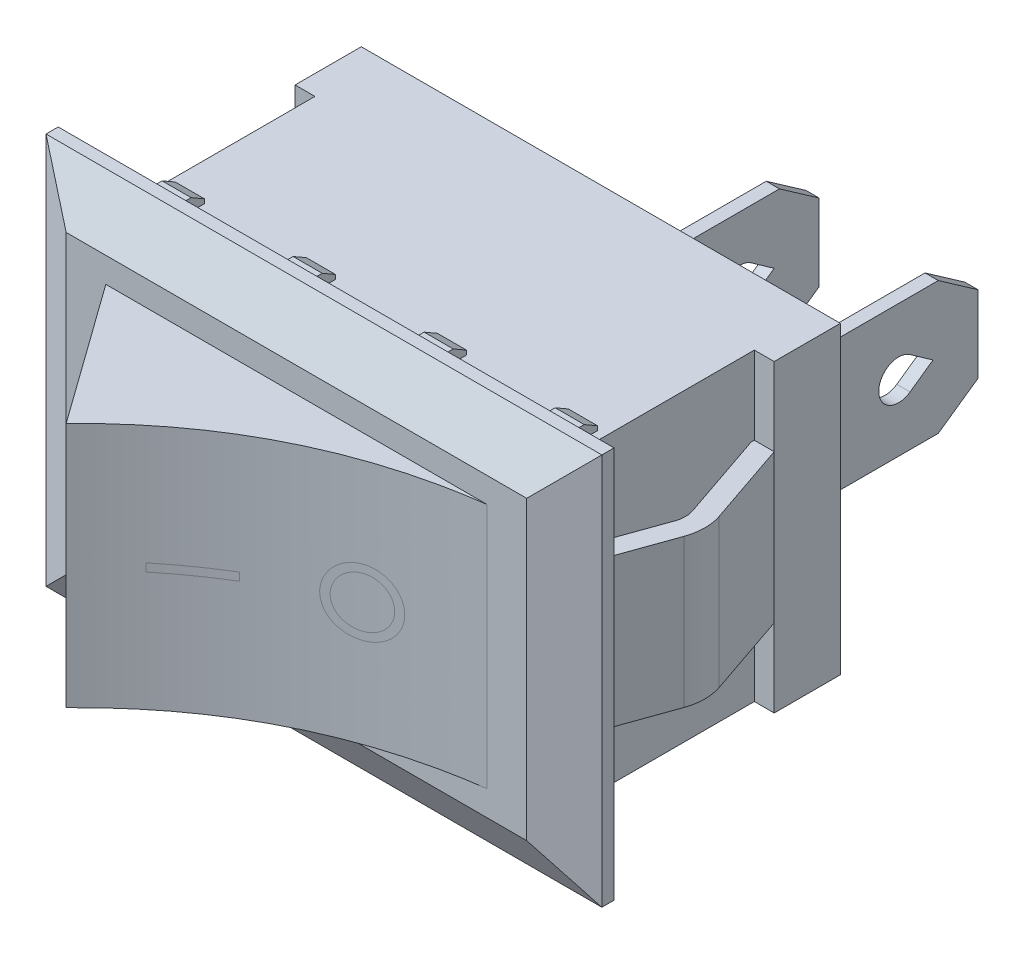
from build123d import *
from OCP.BRepFilletAPI import BRepFilletAPI_MakeChamfer

# Parameters (mm, degrees)
SKETCH1_W                       = 16.6
SKETCH1_H                       = 11.5
BOSS_EXTRUDE1_DEPTH             = 10
SKETCH2_W                       = 21
SKETCH2_H                       = 14.8
BOSS_EXTRUDE2_DEPTH             = 1.5
SKETCH3_W                       = 0.5
SKETCH3_H                       = 5
BOSS_EXTRUDE3_DEPTH             = 8
SKETCH4_W                       = 0.5
SKETCH4_H                       = 0.4
CUT_EXTRUDE1_DEPTH              = 22.623424798
BOSS_EXTRUDE4_REACH             = 19.241
SKETCH5_W                       = 0.75
SKETCH5_H                       = 2.5
BOSS_EXTRUDE4_DIRECTION_2_REACH = 19.241
BOSS_EXTRUDE5_DEPTH             = 2.8
BOSS_EXTRUDE5_DEPTH_BACK        = 2.8
CHAMFER1_SIZE                   = 1.8
CHAMFER1_SIZE2                  = 1.039230485
BOSS_EXTRUDE6_DEPTH             = 4.65
SKETCH9_W                       = 1.1
SKETCH9_H                       = 0.45
BOSS_EXTRUDE7_DEPTH             = 1.9
CHAMFER2_SIZE                   = 0.5
CHAMFER2_SIZE2                  = 0.288675135


with BuildPart() as part:
    # Sketch1 → Boss-Extrude1 (new body)
    with BuildSketch(Plane.XY):
        Rectangle(SKETCH1_W, SKETCH1_H)
    extrude(amount=BOSS_EXTRUDE1_DEPTH)

    # Sketch2 → Boss-Extrude2 (add)
    with BuildSketch(Plane.XY.offset(10)):
        Rectangle(SKETCH2_W, SKETCH2_H)
    extrude(amount=BOSS_EXTRUDE2_DEPTH)

    # Sketch3 → Boss-Extrude3 (add)
    with BuildSketch(Plane(origin=(0, 0, 0), x_dir=(-1, 0, 0), z_dir=(0, 0, -1))):
        with Locations((-6, 0)):
            Rectangle(SKETCH3_W, SKETCH3_H)
        Rectangle(SKETCH3_W, SKETCH3_H)
    extrude(amount=BOSS_EXTRUDE3_DEPTH)

    # Sketch4 → Cut-Extrude1 (cut, through all)
    with BuildSketch(Plane(origin=(6.25, 0, 0), x_dir=(0, 0, -1), z_dir=(1, 0, 0))):
        with Locations((2.25, 2.3)):
            Rectangle(SKETCH4_W, SKETCH4_H)
        with BuildLine():
            Line((0, 0.75), (0, -0.75))
            ThreePointArc((0, -0.75), (0.75, 0), (0, 0.75))
        make_face()
        Polygon((6.5, 2.5), (8, 1.449688693), (8, 2.5), align=None)
        with BuildLine():
            Line((5.432692308, 0.612598863), (6.3, 0))
            Line((6.3, 0), (5.432692308, -0.612598863))
            ThreePointArc((5.432692308, -0.612598863), (4.25, 0), (5.432692308, 0.612598863))
        make_face()
        Polygon((8, -2.5), (8, -1.449688693), (6.5, -2.5), align=None)
        with Locations((2.25, -2.3)):
            Rectangle(SKETCH4_W, SKETCH4_H)
    extrude(amount=-CUT_EXTRUDE1_DEPTH, mode=Mode.SUBTRACT)

    # Boss-Extrude4: up to this face of the body (flat: up to its plane)
    boss_extrude4_end = Plane(part.part.faces().sort_by_distance((0, 5.75, 5))[0])
    # Sketch5 → Boss-Extrude4 (add, up to the picked face)
    with BuildSketch(Plane(origin=(0, 0, 0), x_dir=(1, 0, 0), z_dir=(0, 1, 0)), mode=Mode.PRIVATE) as boss_extrude4_sk1:
        with Locations((-8.675, -1.25)):
            Rectangle(SKETCH5_W, SKETCH5_H)
    boss_extrude4_tool1 = split(extrude(boss_extrude4_sk1.sketch, amount=BOSS_EXTRUDE4_REACH, mode=Mode.PRIVATE), bisect_by=boss_extrude4_end, keep=Keep.BOTH, mode=Mode.PRIVATE)
    boss_extrude4 = boss_extrude4_tool1.solids().sort_by(Axis((-8.675, 0, 1.25), (0, 1, 0)))[0]
    add(boss_extrude4)

    # Boss-Extrude4 direction 2: up to this face of the body (flat: up to its plane)
    boss_extrude4_direction_2_end = Plane(part.part.faces().sort_by_distance((0, -5.75, 5))[0])
    # Sketch5 → Boss-Extrude4 direction 2 (add, up to the picked face)
    with BuildSketch(Plane(origin=(0, 0, 0), x_dir=(1, 0, 0), z_dir=(0, 1, 0)), mode=Mode.PRIVATE) as boss_extrude4_direction_2_sk1:
        with Locations((-8.675, -1.25)):
            Rectangle(SKETCH5_W, SKETCH5_H)
    boss_extrude4_direction_2_tool1 = split(extrude(boss_extrude4_direction_2_sk1.sketch, amount=-BOSS_EXTRUDE4_DIRECTION_2_REACH, mode=Mode.PRIVATE), bisect_by=boss_extrude4_direction_2_end, keep=Keep.BOTH, mode=Mode.PRIVATE)
    boss_extrude4_direction_2 = boss_extrude4_direction_2_tool1.solids().sort_by(Axis((-8.675, 0, 1.25), (0, -1, 0)))[0]
    add(boss_extrude4_direction_2)

    # Mirror1: Boss-Extrude4, Boss-Extrude4 direction 2 across plane
    add(boss_extrude4.mirror(Plane(origin=(0, 0, 0), x_dir=(0, 0, 1), z_dir=(1, 0, 0))))
    add(boss_extrude4_direction_2.mirror(Plane(origin=(0, 0, 0), x_dir=(0, 0, 1), z_dir=(1, 0, 0))))

    # Sketch6 → Boss-Extrude5 (add, two sides: drawn at the far end of the back side and taken through both)
    with BuildSketch(Plane(origin=(0, 0, 0), x_dir=(1, 0, 0), z_dir=(0, 1, 0)).offset(-BOSS_EXTRUDE5_DEPTH_BACK)):
        with BuildLine():
            Line((-9.05, -2.5), (-10.124907983, -5.653347952))
            ThreePointArc((-10.124907983, -5.653347952), (-10.231819447, -6.312838644), (-10.115557515, -6.970745323))
            Line((-10.115557515, -6.970745323), (-9.056614332, -9.938626949))
            Line((-9.056614332, -9.938626949), (-9.034716365, -10))
            Line((-9.034716365, -10), (-8.3, -10))
            Line((-8.3, -10), (-8.3, -9.827371619))
            Line((-8.3, -9.827371619), (-8.350231447, -9.686588817))
            Line((-8.350231447, -9.686588817), (-9.438479941, -6.636573707))
            ThreePointArc((-9.438479941, -6.636573707), (-9.496610907, -6.307620368), (-9.443155175, -5.977875022))
            Line((-9.443155175, -5.977875022), (-8.34011069, -2.741985882))
            Line((-8.34011069, -2.741985882), (-8.3, -2.624317241))
            Line((-8.3, -2.624317241), (-8.3, -2.5))
            Line((-8.3, -2.5), (-9.05, -2.5))
        make_face()
        with BuildLine():
            Line((8.3, -9.827371619), (8.350231447, -9.686588817))
            Line((8.350231447, -9.686588817), (9.438479941, -6.636573707))
            ThreePointArc((9.438479941, -6.636573707), (9.496610907, -6.307620368), (9.443155175, -5.977875022))
            Line((9.443155175, -5.977875022), (8.34011069, -2.741985882))
            Line((8.34011069, -2.741985882), (8.3, -2.624317241))
            Line((8.3, -2.624317241), (8.3, -2.5))
            Line((8.3, -2.5), (9.05, -2.5))
            Line((9.05, -2.5), (10.124907983, -5.653347952))
            ThreePointArc((10.124907983, -5.653347952), (10.231819447, -6.312838644), (10.115557515, -6.970745323))
            Line((10.115557515, -6.970745323), (9.056614332, -9.938626949))
            Line((9.056614332, -9.938626949), (9.034716365, -10))
            Line((9.034716365, -10), (8.3, -10))
            Line((8.3, -10), (8.3, -9.827371619))
        make_face()
    extrude(amount=BOSS_EXTRUDE5_DEPTH + BOSS_EXTRUDE5_DEPTH_BACK)

    # Chamfer1
    chamfer1_edges = [part.edges().sort_by_distance(p)[0] for p in [
        (10.5, 0, 11.5),
        (0, 7.4, 11.5),
        (-10.5, 0, 11.5),
        (0, -7.4, 11.5),
    ]]
    chamfer1_side = [part.faces().sort_by_distance(p)[0] for p in [
        (0, 0, 11.5),
    ]]
    chamfer(chamfer1_edges, length=CHAMFER1_SIZE, length2=CHAMFER1_SIZE2, reference=chamfer1_side[0])

    # Sketch7 → Boss-Extrude6 (add, symmetric)
    with BuildSketch(Plane(origin=(0, 0, 0), x_dir=(1, 0, 0), z_dir=(0, 1, 0))):
        with BuildLine():
            Line((-7.2, -11.5), (-3.398718251, -16.8))
            add(Edge.make_bspline(
                [(-3.398718251, -16.8), (0.927387699, -12.334784825), (7.2, -11.5)],
                knots=[0, 0, 0, 1, 1, 1], degree=2))
            Line((7.2, -11.5), (-7.2, -11.5))
        make_face()
    extrude(amount=BOSS_EXTRUDE6_DEPTH, both=True)

    # Sketch9 → Boss-Extrude7 (add)
    with BuildSketch(Plane(origin=(0, 0, 10), x_dir=(-1, 0, 0), z_dir=(0, 0, -1))):
        with Locations((-7.425, 5.975)):
            Rectangle(SKETCH9_W, SKETCH9_H)
        with Locations((-2.475, 5.975)):
            Rectangle(SKETCH9_W, SKETCH9_H)
        with Locations((2.475, 5.975)):
            Rectangle(SKETCH9_W, SKETCH9_H)
        with Locations((7.425, 5.975)):
            Rectangle(SKETCH9_W, SKETCH9_H)
        with Locations((7.425, -5.975)):
            Rectangle(SKETCH9_W, SKETCH9_H)
        with Locations((2.475, -5.975)):
            Rectangle(SKETCH9_W, SKETCH9_H)
        with Locations((-2.475, -5.975)):
            Rectangle(SKETCH9_W, SKETCH9_H)
        with Locations((-7.425, -5.975)):
            Rectangle(SKETCH9_W, SKETCH9_H)
    extrude(amount=BOSS_EXTRUDE7_DEPTH)

    # Chamfer2: one chamfer whose edges measure the first distance from different faces: ONE call of the kernel's chamfer builder (chamfer() names one face for all edges)
    chamfer2_edges_1 = [part.edges().sort_by_distance(p)[0] for p in [
        (7.425, 6.2, 8.1),
    ]]
    chamfer2_side_1 = [part.faces().sort_by_distance(p)[0] for p in [
        (7.425, 6.2, 9.05),
    ]]
    chamfer2_edges_2 = [part.edges().sort_by_distance(p)[0] for p in [
        (2.475, 6.2, 8.1),
    ]]
    chamfer2_side_2 = [part.faces().sort_by_distance(p)[0] for p in [
        (2.475, 6.2, 9.05),
    ]]
    chamfer2_edges_3 = [part.edges().sort_by_distance(p)[0] for p in [
        (-2.475, 6.2, 8.1),
    ]]
    chamfer2_side_3 = [part.faces().sort_by_distance(p)[0] for p in [
        (-2.475, 6.2, 9.05),
    ]]
    chamfer2_edges_4 = [part.edges().sort_by_distance(p)[0] for p in [
        (-7.425, 6.2, 8.1),
    ]]
    chamfer2_side_4 = [part.faces().sort_by_distance(p)[0] for p in [
        (-7.425, 6.2, 9.05),
    ]]
    chamfer2_edges_5 = [part.edges().sort_by_distance(p)[0] for p in [
        (-7.425, -6.2, 8.1),
    ]]
    chamfer2_side_5 = [part.faces().sort_by_distance(p)[0] for p in [
        (-7.425, -6.2, 9.05),
    ]]
    chamfer2_edges_6 = [part.edges().sort_by_distance(p)[0] for p in [
        (-2.475, -6.2, 8.1),
    ]]
    chamfer2_side_6 = [part.faces().sort_by_distance(p)[0] for p in [
        (-2.475, -6.2, 9.05),
    ]]
    chamfer2_edges_7 = [part.edges().sort_by_distance(p)[0] for p in [
        (2.475, -6.2, 8.1),
    ]]
    chamfer2_side_7 = [part.faces().sort_by_distance(p)[0] for p in [
        (2.475, -6.2, 9.05),
    ]]
    chamfer2_edges_8 = [part.edges().sort_by_distance(p)[0] for p in [
        (7.425, -6.2, 8.1),
    ]]
    chamfer2_side_8 = [part.faces().sort_by_distance(p)[0] for p in [
        (7.425, -6.2, 9.05),
    ]]
    chamfer2 = BRepFilletAPI_MakeChamfer(part.part.solid().wrapped)
    for e in chamfer2_edges_1:
        chamfer2.Add(CHAMFER2_SIZE, CHAMFER2_SIZE2, e.wrapped, chamfer2_side_1[0].wrapped)  # the first distance lies on this face
    for e in chamfer2_edges_2:
        chamfer2.Add(CHAMFER2_SIZE, CHAMFER2_SIZE2, e.wrapped, chamfer2_side_2[0].wrapped)  # the first distance lies on this face
    for e in chamfer2_edges_3:
        chamfer2.Add(CHAMFER2_SIZE, CHAMFER2_SIZE2, e.wrapped, chamfer2_side_3[0].wrapped)  # the first distance lies on this face
    for e in chamfer2_edges_4:
        chamfer2.Add(CHAMFER2_SIZE, CHAMFER2_SIZE2, e.wrapped, chamfer2_side_4[0].wrapped)  # the first distance lies on this face
    for e in chamfer2_edges_5:
        chamfer2.Add(CHAMFER2_SIZE, CHAMFER2_SIZE2, e.wrapped, chamfer2_side_5[0].wrapped)  # the first distance lies on this face
    for e in chamfer2_edges_6:
        chamfer2.Add(CHAMFER2_SIZE, CHAMFER2_SIZE2, e.wrapped, chamfer2_side_6[0].wrapped)  # the first distance lies on this face
    for e in chamfer2_edges_7:
        chamfer2.Add(CHAMFER2_SIZE, CHAMFER2_SIZE2, e.wrapped, chamfer2_side_7[0].wrapped)  # the first distance lies on this face
    for e in chamfer2_edges_8:
        chamfer2.Add(CHAMFER2_SIZE, CHAMFER2_SIZE2, e.wrapped, chamfer2_side_8[0].wrapped)  # the first distance lies on this face
    add(Compound.cast(chamfer2.Shape()), mode=Mode.REPLACE)


solid = part.part
